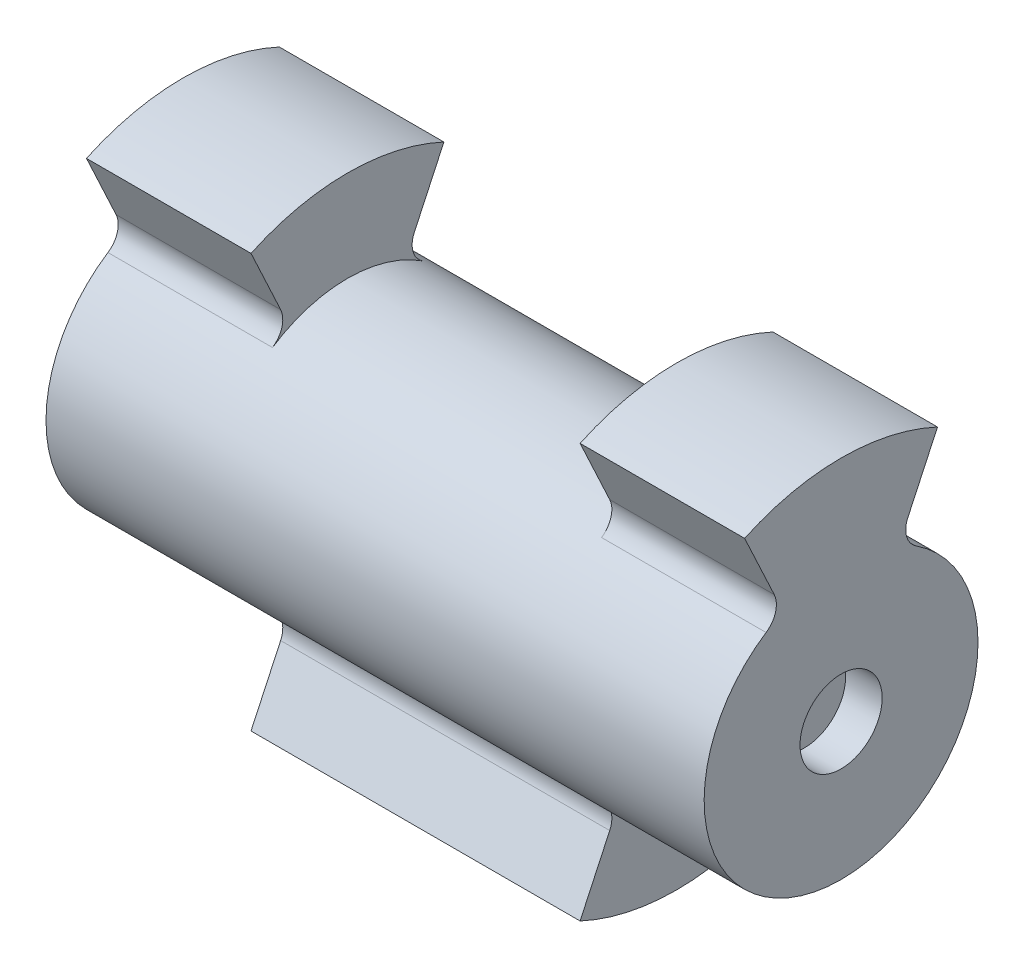
from build123d import *

# Parameters (mm, degrees)
BOSS_EXTRUDE1_DEPTH      = 72.1
BOSS_EXTRUDE1_DEPTH_BACK = 72.1
SKETCH1_R                = 30
BOSS_EXTRUDE2_DEPTH      = 36.05
BOSS_EXTRUDE3_DEPTH      = 36.05
BOSS_EXTRUDE3_DEPTH_BACK = 36.05
SKETCH5_R                = 9
CUT_EXTRUDE1_DEPTH       = 8
FILLET1_R                = 5


with BuildPart() as part:
    # Sketch1 → Boss-Extrude1 (new, two sides: drawn at the far end of the back side and taken through both)
    with BuildSketch(Plane(origin=(0, 0, 0), x_dir=(0, 0, -1), z_dir=(1, 0, 0)).offset(-BOSS_EXTRUDE1_DEPTH_BACK)):
        Circle(SKETCH1_R)
    extrude(amount=BOSS_EXTRUDE1_DEPTH + BOSS_EXTRUDE1_DEPTH_BACK)

    # Sketch3 → Boss-Extrude2 (add)
    with BuildSketch(Plane(origin=(72.1, 0, 0), x_dir=(0, 0, -1), z_dir=(1, 0, 0))):
        with BuildLine():
            Line((7.607128711, 16.313540167), (21.130913087, 45.315389352))
            ThreePointArc((21.130913087, 45.315389352), (0, 50), (-21.130913087, 45.315389352))
            Line((-21.130913087, 45.315389352), (-7.607128711, 16.313540167))
            ThreePointArc((-7.607128711, 16.313540167), (0, 18), (7.607128711, 16.313540167))
        make_face()
    extrude(amount=-BOSS_EXTRUDE2_DEPTH)

    # Mirror1: part across plane


with BuildPart() as part_1:
    add(part.part)
    add(part.part.mirror(Plane(origin=(0, 0, 0), x_dir=(0, 0, 1), z_dir=(1, 0, 0))))

    # Sketch4 → Boss-Extrude3 (add, two sides: drawn at the far end of the back side and taken through both)
    with BuildSketch(Plane(origin=(0, 0, 0), x_dir=(0, 0, -1), z_dir=(1, 0, 0)).offset(-BOSS_EXTRUDE3_DEPTH_BACK)):
        with BuildLine():
            Line((-7.607128711, -16.313540167), (-21.130913087, -45.315389352))
            ThreePointArc((-21.130913087, -45.315389352), (0, -50), (21.130913087, -45.315389352))
            Line((21.130913087, -45.315389352), (7.607128711, -16.313540167))
            ThreePointArc((7.607128711, -16.313540167), (0, -18), (-7.607128711, -16.313540167))
        make_face()
    extrude(amount=BOSS_EXTRUDE3_DEPTH + BOSS_EXTRUDE3_DEPTH_BACK)

    # Sketch5 → Cut-Extrude1 (cut)
    with BuildSketch(Plane(origin=(72.1, 0, 0), x_dir=(0, 0, -1), z_dir=(1, 0, 0))):
        Circle(SKETCH5_R)
    cut_extrude1 = extrude(amount=-CUT_EXTRUDE1_DEPTH, mode=Mode.SUBTRACT)

    # Mirror3: Cut-Extrude1 across plane
    add(cut_extrude1.mirror(Plane(origin=(0, 0, 0), x_dir=(0, 0, 1), z_dir=(1, 0, 0))), mode=Mode.SUBTRACT)

    # Fillet1
    fillet1_edges = [part_1.edges().sort_by_distance(p)[0] for p in [
        (0, -27.189233611, 12.678547852),
        (0, -27.189233611, -12.678547852),
        (54.075, 27.189233611, -12.678547852),
        (54.075, 27.189233611, 12.678547852),
        (-54.075, 27.189233611, -12.678547852),
        (-54.075, 27.189233611, 12.678547852),
    ]]
    fillet(fillet1_edges, radius=FILLET1_R)


solid = part_1.part
